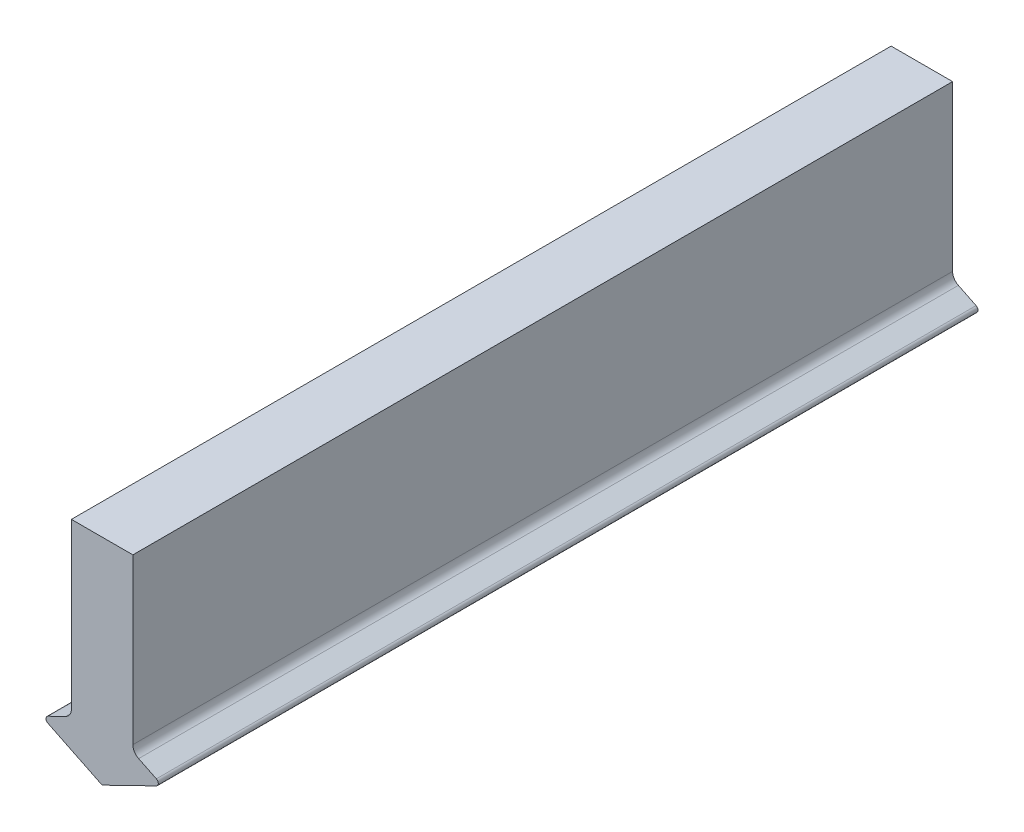
from build123d import *

# Parameters (mm, degrees)
ESTRUSIONE_ESTRUSIONE1_DEPTH = 48


with BuildPart() as part:
    # Schizzo1 → Estrusione-Estrusione1 (new body)
    with BuildSketch(Plane.XY):
        with BuildLine():
            Line((0, 0), (-3.175204989, 1.548650948))
            ThreePointArc((-3.175204989, 1.548650948), (-3.287530759, 1.728409758), (-3.175204989, 1.908168567))
            Line((-3.175204989, 1.908168567), (-2.136976869, 2.414546255))
            ThreePointArc((-2.136976869, 2.414546255), (-1.891170699, 2.635871124), (-1.799999557, 2.953822683))
            Line((-1.799999557, 2.953822683), (-1.799999557, 12.578901072))
            Line((-1.799999557, 12.578901072), (1.799999557, 12.578901072))
            Line((1.799999557, 12.578901072), (1.799999557, 2.953822683))
            ThreePointArc((1.799999557, 2.953822683), (1.891170699, 2.635871124), (2.136976869, 2.414546255))
            Line((2.136976869, 2.414546255), (3.175204989, 1.908168567))
            ThreePointArc((3.175204989, 1.908168567), (3.287530759, 1.728409758), (3.175204989, 1.548650948))
            Line((3.175204989, 1.548650948), (0, 0))
        make_face()
    extrude(amount=ESTRUSIONE_ESTRUSIONE1_DEPTH)


solid = part.part
